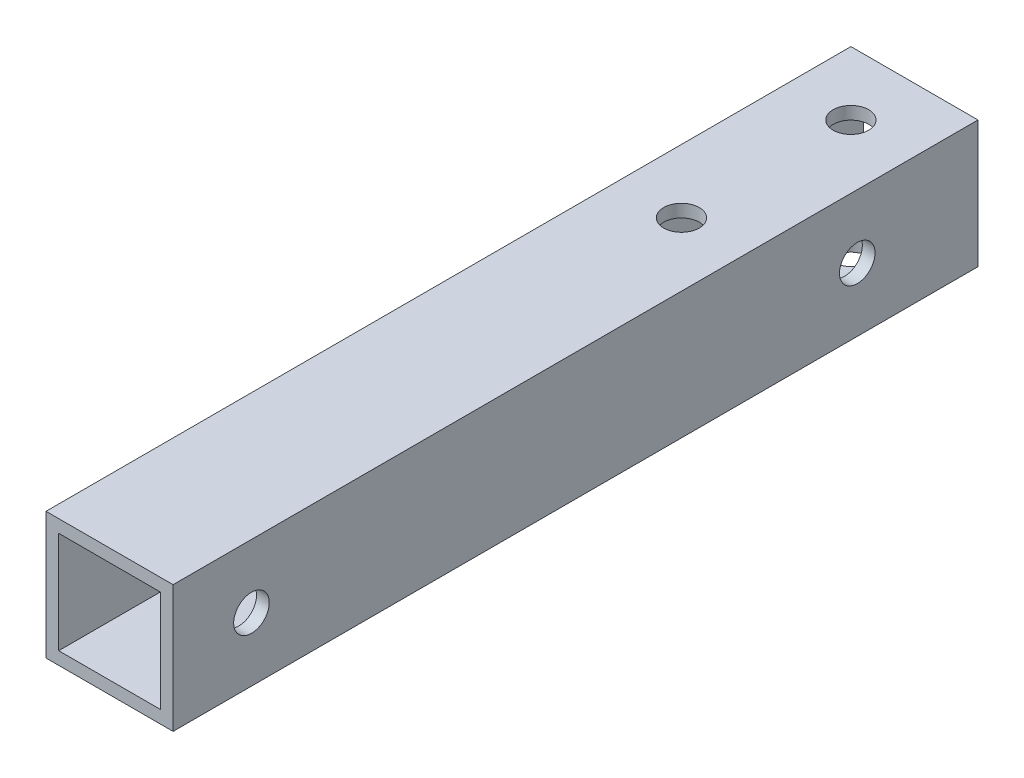
from build123d import *

# Parameters (mm, degrees)
SKETCH_1_W          = 15
SKETCH_1_H          = 15
SKETCH_1_W_2        = 12
SKETCH_1_H_2        = 12
EXTRUDE_1_DEPTH     = 95
SKETCH_2_R          = 2.1
CUT_EXTRUDE_1_DEPTH = 97.468906908
SKETCH_3_R          = 2.1
CUT_EXTRUDE_2_DEPTH = 97.468906908


with BuildPart() as part:
    # ｽｹｯﾁ1 → 押し出し-薄板1 (new body)
    with BuildSketch(Plane.XY):
        Rectangle(SKETCH_1_W, SKETCH_1_H)
        Rectangle(SKETCH_1_W_2, SKETCH_1_H_2, mode=Mode.SUBTRACT)
    extrude(amount=EXTRUDE_1_DEPTH)

    # ｽｹｯﾁ2 → ｶｯﾄ - 押し出し1 (cut, through all)
    with BuildSketch(Plane(origin=(7.5, 0, 0), x_dir=(0, 0, -1), z_dir=(1, 0, 0))):
        with Locations(Location((-14.25, 0, 0), (0, 0, 90))):
            Circle(SKETCH_2_R)
        with Locations(Location((-85.75, 0, 0), (0, 0, 90))):
            Circle(SKETCH_2_R)
    extrude(amount=-CUT_EXTRUDE_1_DEPTH, mode=Mode.SUBTRACT)

    # ｽｹｯﾁ3 → ｶｯﾄ - 押し出し2 (cut, through all)
    with BuildSketch(Plane(origin=(0, 7.5, 0), x_dir=(1, 0, 0), z_dir=(0, 1, 0))):
        with Locations(Location((0, -27.5, 0), (0, 0, 270))):
            Circle(SKETCH_3_R)
        with Locations(Location((0, -7.5, 0), (0, 0, 270))):
            Circle(SKETCH_3_R)
    extrude(amount=-CUT_EXTRUDE_2_DEPTH, mode=Mode.SUBTRACT)


solid = part.part
